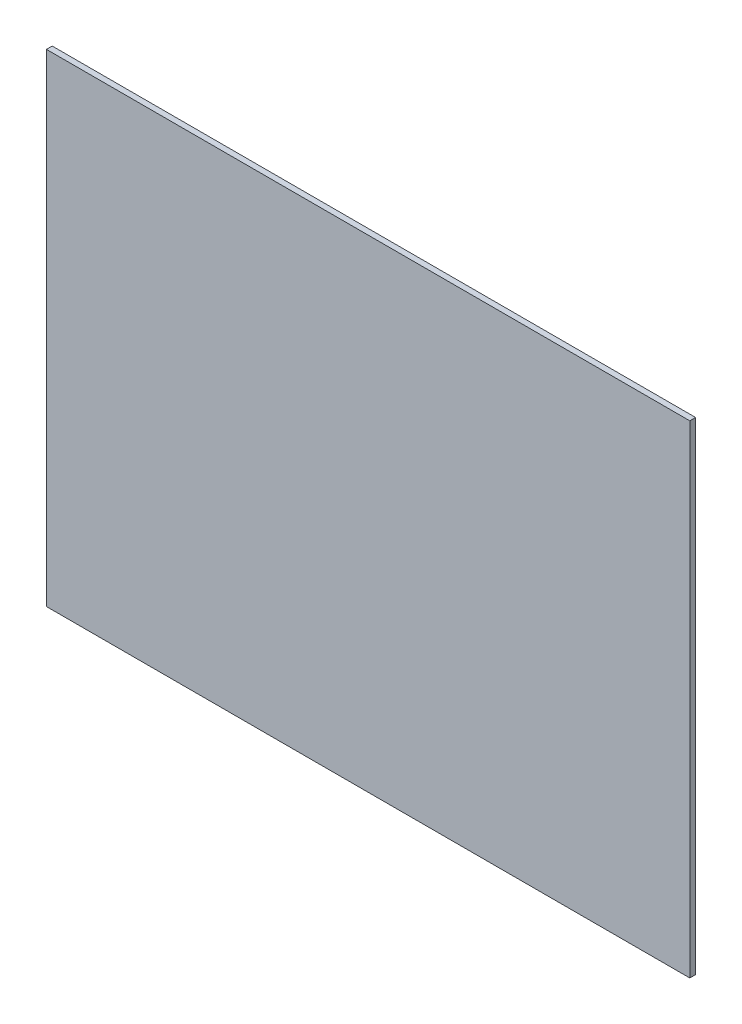
from build123d import *

# Parameters (mm, degrees)
SKETCH_1_W      = 400
SKETCH_1_H      = 300
EXTRUDE_1_DEPTH = 3.6


with BuildPart() as part:
    # 草图1 → 凸台-拉伸1 (new body)
    with BuildSketch(Plane.XY):
        Rectangle(SKETCH_1_W, SKETCH_1_H)
    extrude(amount=EXTRUDE_1_DEPTH)


solid = part.part
